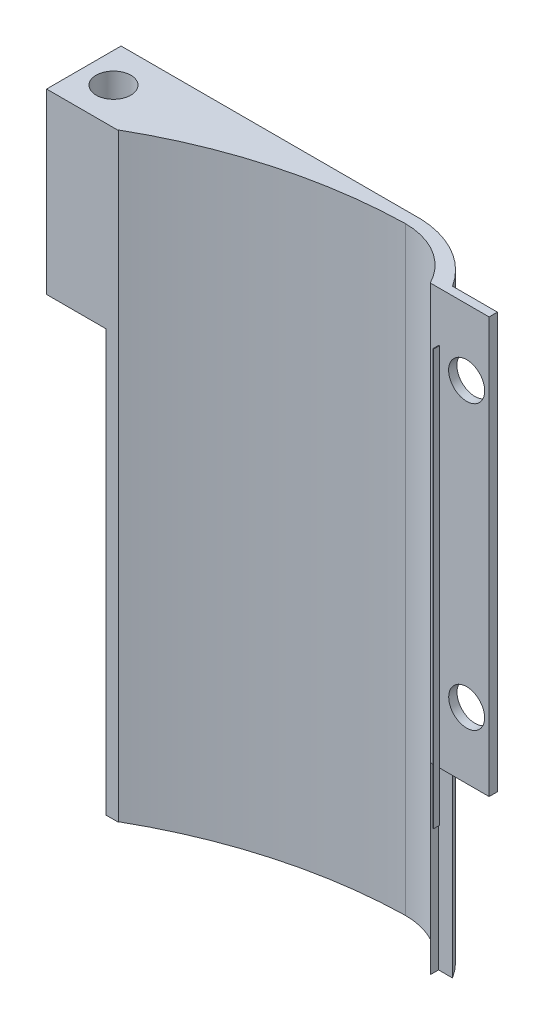
from build123d import *

# Parameters (mm, degrees)
BOSS_EXTRUDE1_DEPTH      = 127
BOSS_EXTRUDE1_DEPTH_BACK = 1.27
SKETCH1_W                = 67.320921889
SKETCH1_H                = 31.744824956
BOSS_EXTRUDE2_DEPTH      = 38.1
SKETCH3_R                = 3.798675559
CUT_EXTRUDE1_DEPTH       = 53.34
SKETCH4_R                = 3.713025355
CUT_EXTRUDE2_DEPTH       = 72.898
CUT_EXTRUDE3_DEPTH       = 177.8
CUT_EXTRUDE4_DEPTH       = 140.752657
SKETCH7_W                = 12.598265338
SKETCH7_H                = 1.777860749
BOSS_EXTRUDE3_DEPTH      = 88.936657
SKETCH8_W                = 12.621827424
SKETCH8_H                = 1.259783395
BOSS_EXTRUDE4_DEPTH      = 88.936657
SKETCH9_R                = 3.862443539
CUT_EXTRUDE5_DEPTH       = 31.278657
SKETCH10_R               = 3.842033399
CUT_EXTRUDE6_DEPTH       = 32.548657
SKETCH12_W               = 89.492799736
SKETCH12_H               = 16.90476451
CUT_EXTRUDE7_DEPTH       = 138.176
CUT_EXTRUDE8_DEPTH       = 2.54
CUT_EXTRUDE9_DEPTH       = 132.08


with BuildPart() as part:
    # Sketch1 → Boss-Extrude1 (new, two sides: drawn at the far end of the back side and taken through both)
    with BuildSketch(Plane(origin=(0, 0, 0), x_dir=(1, 0, 0), z_dir=(0, 1, 0)).offset(-BOSS_EXTRUDE1_DEPTH_BACK)):
        with Locations((33.660460945, -15.872412478)):
            Rectangle(SKETCH1_W, SKETCH1_H)
    extrude(amount=BOSS_EXTRUDE1_DEPTH + BOSS_EXTRUDE1_DEPTH_BACK)

    # Sketch2 → Boss-Extrude2 (add)
    with BuildSketch(Plane(origin=(0, 127, 0), x_dir=(1, 0, 0), z_dir=(0, 1, 0))):
        Polygon((0, 0), (-12.691812955, 0), (-12.691812955, -31.893008725), (0, -31.744824956), align=None)
    extrude(amount=-BOSS_EXTRUDE2_DEPTH)

    # Sketch3 → Cut-Extrude1 (cut)
    with BuildSketch(Plane(origin=(0, 127, 0), x_dir=(1, 0, 0), z_dir=(0, 1, 0))):
        with Locations(Location((-6.345906477, -23.919756544, 0), (0, 0, 270))):
            Circle(SKETCH3_R)
    extrude(amount=-CUT_EXTRUDE1_DEPTH, mode=Mode.SUBTRACT)

    # Sketch4 → Cut-Extrude2 (cut)
    with BuildSketch(Plane(origin=(0, 127, 0), x_dir=(1, 0, 0), z_dir=(0, 1, 0))):
        with Locations(Location((-6.238928802, -8.074927798, 0), (0, 0, 270))):
            Circle(SKETCH4_R)
    extrude(amount=-CUT_EXTRUDE2_DEPTH, mode=Mode.SUBTRACT)

    # Sketch5 → Cut-Extrude3 (cut)
    with BuildSketch(Plane(origin=(0, 127, 0), x_dir=(1, 0, 0), z_dir=(0, 1, 0))):
        with BuildLine():
            ThreePointArc((64.884408785, -12.014730435), (65.337632333, -15.775676375), (64.884408785, -19.536622316))
            ThreePointArc((64.884408785, -19.536622316), (59.764565977, -27.313148833), (50.645455775, -29.191707899))
            ThreePointArc((50.645455775, -29.191707899), (25.520797189, -26.413912497), (2.545998088, -15.872412478))
            ThreePointArc((2.545998088, -15.872412478), (25.757322084, -6.167748294), (50.645455775, -2.489858962))
            ThreePointArc((50.645455775, -2.489858962), (59.21392875, -5.086156005), (64.884408785, -12.014730435))
        make_face()
    extrude(amount=-CUT_EXTRUDE3_DEPTH, mode=Mode.SUBTRACT)

    # Sketch6 → Cut-Extrude4 (cut)
    with BuildSketch(Plane(origin=(0, 127, 0), x_dir=(1, 0, 0), z_dir=(0, 1, 0))):
        Polygon((64.338150371, -15.872412478), (64.338150371, -22.747923603), (67.320921889, -22.747923603), (67.320921889, -9.054734185), (64.338150371, -9.054734185), align=None)
    extrude(amount=-CUT_EXTRUDE4_DEPTH, mode=Mode.SUBTRACT)

    # Sketch7 → Boss-Extrude3 (add)
    with BuildSketch(Plane(origin=(0, 127, 0), x_dir=(1, 0, 0), z_dir=(0, 1, 0))):
        with Locations((70.63728304, -9.94366456)):
            Rectangle(SKETCH7_W, SKETCH7_H)
    extrude(amount=-BOSS_EXTRUDE3_DEPTH)

    # Sketch8 → Boss-Extrude4 (add)
    with BuildSketch(Plane(origin=(0, 127, 0), x_dir=(1, 0, 0), z_dir=(0, 1, 0))):
        with Locations((70.649064083, -22.118031906)):
            Rectangle(SKETCH8_W, SKETCH8_H)
    extrude(amount=-BOSS_EXTRUDE4_DEPTH)

    # Sketch9 → Cut-Extrude5 (cut)
    with BuildSketch(Plane(origin=(0, 0, 9.054734185), x_dir=(-1, 0, 0), z_dir=(0, 0, -1))):
        with Locations((-72.128668799, 112.805210201)):
            Circle(SKETCH9_R)
    extrude(amount=-CUT_EXTRUDE5_DEPTH, mode=Mode.SUBTRACT)

    # Sketch10 → Cut-Extrude6 (cut)
    with BuildSketch(Plane(origin=(0, 0, 9.054734185), x_dir=(-1, 0, 0), z_dir=(0, 0, -1))):
        with Locations((-72.128668799, 52.198950376)):
            Circle(SKETCH10_R)
    extrude(amount=-CUT_EXTRUDE6_DEPTH, mode=Mode.SUBTRACT)

    # Sketch12 → Cut-Extrude7 (cut)
    with BuildSketch(Plane(origin=(0, 127, 0), x_dir=(1, 0, 0), z_dir=(0, 1, 0))):
        with Locations((32.054586913, -24.398886618)):
            Rectangle(SKETCH12_W, SKETCH12_H)
    extrude(amount=-CUT_EXTRUDE7_DEPTH, mode=Mode.SUBTRACT)


with BuildPart() as cut_extrude7_piece_1:
    # of the separate pieces the step leaves, piece 1, a body of its own (cut_extrude7_pieces)
    add(part.part.solids().sort_by_distance((67.320921889, 127, 0))[0])

    # Sketch13 → Cut-Extrude8 (cut)
    with BuildSketch(Plane.XZ.offset(-88.9)):
        Polygon((0, 8.074927798), (-3.119464401, 13.477998634), (-9.358393203, 13.477998634), (-12.477857605, 8.074927798), (-9.358393203, 2.671856963), (-3.119464401, 2.671856963), align=None)
    extrude(amount=-CUT_EXTRUDE8_DEPTH, mode=Mode.SUBTRACT)

    # Sketch14 → Cut-Extrude9 (cut)
    with BuildSketch(Plane(origin=(0, 127, 0), x_dir=(1, 0, 0), z_dir=(0, 1, 0))):
        with BuildLine():
            Line((67.320921889, 0), (51.591028303, 0))
            ThreePointArc((51.591028303, 0), (60.568888098, -2.594013475), (67.320921889, -9.054734185))
            Line((67.320921889, -9.054734185), (67.320921889, 0))
        make_face()
    extrude(amount=-CUT_EXTRUDE9_DEPTH, mode=Mode.SUBTRACT)


with BuildPart() as cut_extrude7_piece_2:
    # of the separate pieces the step leaves, piece 2, a body of its own (cut_extrude7_pieces)
    add(part.part.solids().sort_by_distance((76.800986781, 127, 21.488140208))[0])


solid = Compound([cut_extrude7_piece_1.part, cut_extrude7_piece_2.part])
